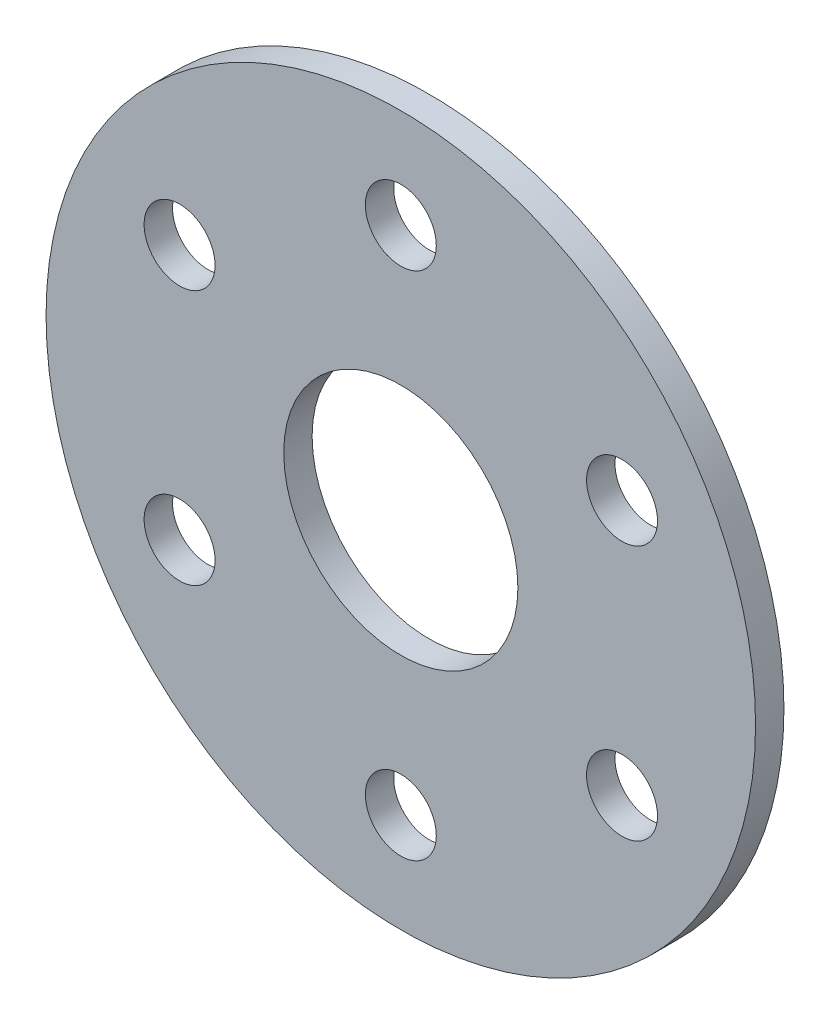
from build123d import *

# Parameters (mm, degrees)
SKETCH1_R           = 25
SKETCH1_R_2         = 8.25
SKETCH1_R_3         = 2.5
BOSS_EXTRUDE1_DEPTH = 1


with BuildPart() as part:
    # Sketch1 (on Front Plane) → Boss-Extrude1 (new, symmetric)
    with BuildSketch(Plane.XY):
        Circle(SKETCH1_R)
        Circle(SKETCH1_R_2, mode=Mode.SUBTRACT)
        with Locations((0, 18)):
            Circle(SKETCH1_R_3, mode=Mode.SUBTRACT)
        with Locations((15.588457268, 9)):
            Circle(SKETCH1_R_3, mode=Mode.SUBTRACT)
        with Locations((15.588457268, -9)):
            Circle(SKETCH1_R_3, mode=Mode.SUBTRACT)
        with Locations((0, -18)):
            Circle(SKETCH1_R_3, mode=Mode.SUBTRACT)
        with Locations((-15.588457268, -9)):
            Circle(SKETCH1_R_3, mode=Mode.SUBTRACT)
        with Locations((-15.588457268, 9)):
            Circle(SKETCH1_R_3, mode=Mode.SUBTRACT)
    extrude(amount=BOSS_EXTRUDE1_DEPTH, both=True)


solid = part.part
